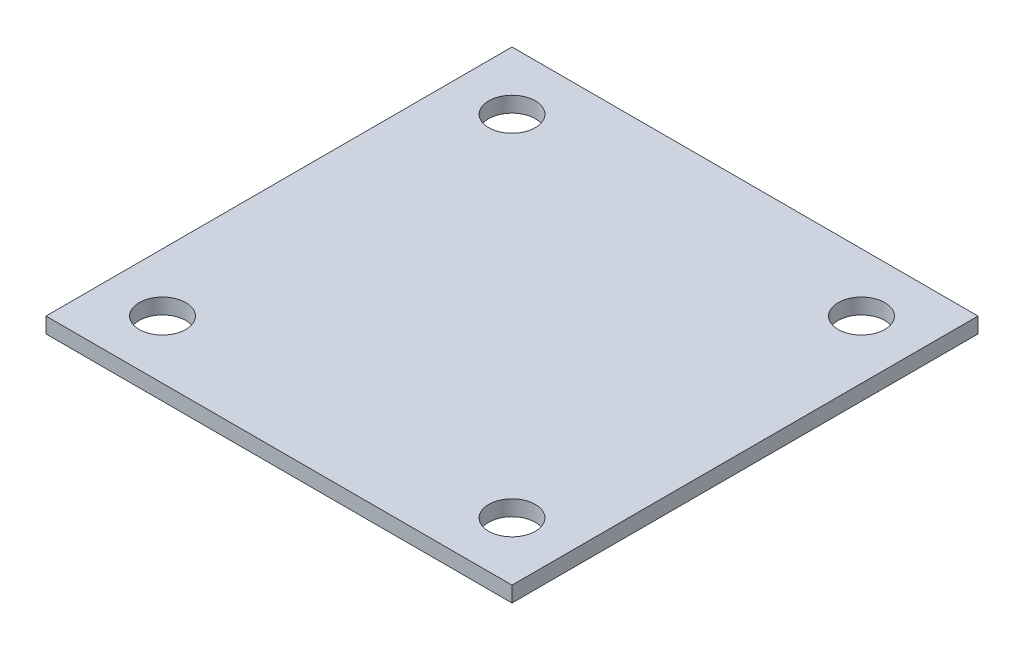
from build123d import *

# Parameters (mm, degrees)
SKETCH_4_W          = 60
SKETCH_4_H          = 60
EXTRUDE_2_DEPTH     = 2
SKETCH_5_R          = 3
CUT_EXTRUDE_1_DEPTH = 43.473521163


with BuildPart() as part:
    # 草图4 → 凸台-拉伸2 (new body)
    with BuildSketch(Plane(origin=(0, 0, 0), x_dir=(1, 0, 0), z_dir=(0, 1, 0))):
        Rectangle(SKETCH_4_W, SKETCH_4_H)
    extrude(amount=EXTRUDE_2_DEPTH)

    # 草图5 → 切除-拉伸1 (cut, through all)
    with BuildSketch(Plane(origin=(0, 2, 0), x_dir=(1, 0, 0), z_dir=(0, 1, 0))):
        with Locations(Location((-22.5, 22.5, 0), (0, 0, 270))):
            Circle(SKETCH_5_R)
        with Locations(Location((22.5, 22.5, 0), (0, 0, 270))):
            Circle(SKETCH_5_R)
        with Locations(Location((-22.5, -22.5, 0), (0, 0, 270))):
            Circle(SKETCH_5_R)
        with Locations(Location((22.5, -22.5, 0), (0, 0, 270))):
            Circle(SKETCH_5_R)
    extrude(amount=-CUT_EXTRUDE_1_DEPTH, mode=Mode.SUBTRACT)


solid = part.part
